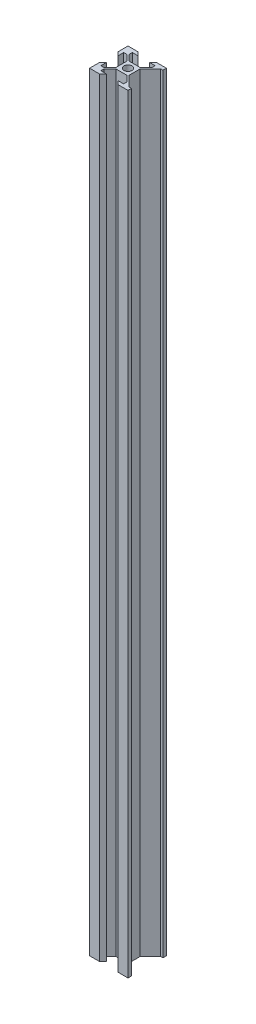
from build123d import *

# Parameters (mm, degrees)
EXTRUDE_1_DEPTH          = 400
CUT_EXTRUDE_1_DEPTH      = 404.236903073
CUT_EXTRUDE_1_DEPTH_BACK = 404.236903073
SKETCH_2_W               = 44.352947912
SKETCH_2_H               = 26.447385174


with BuildPart() as part:
    # 草图1 → 凸台-拉伸1 (new body)
    with BuildSketch(Plane(origin=(0, 0, 0), x_dir=(1, 0, 0), z_dir=(0, 1, 0))):
        with BuildLine():
            Line((-3.476396103, 2.84), (-3.476396103, 0))
            Line((-3.476396103, 0), (-2.1, 0))
            ThreePointArc((-2.1, 0), (-1.48492424, 1.48492424), (0, 2.1))
            Line((0, 2.1), (0, 3.476396103))
            Line((0, 3.476396103), (-2.84, 3.476396103))
            Line((-2.84, 3.476396103), (-5.923603897, 6.56))
            Line((-5.923603897, 6.56), (-5.923603897, 8.2))
            Line((-5.923603897, 8.2), (-3.1, 8.2))
            Line((-3.1, 8.2), (-4.9, 10))
            Line((-4.9, 10), (-10, 10))
            Line((-10, 10), (-10, 4.9))
            Line((-10, 4.9), (-8.2, 3.1))
            Line((-8.2, 3.1), (-8.2, 5.923603897))
            Line((-8.2, 5.923603897), (-6.56, 5.923603897))
            Line((-6.56, 5.923603897), (-3.476396103, 2.84))
        make_face()
        with BuildLine():
            Line((-2.1, 0), (-3.476396103, 0))
            Line((-3.476396103, 0), (-3.476396103, -2.84))
            Line((-3.476396103, -2.84), (-6.56, -5.923603897))
            Line((-6.56, -5.923603897), (-8.2, -5.923603897))
            Line((-8.2, -5.923603897), (-8.2, -3.1))
            Line((-8.2, -3.1), (-10, -4.9))
            Line((-10, -4.9), (-10, -10))
            Line((-10, -10), (-4.9, -10))
            Line((-4.9, -10), (-3.1, -8.2))
            Line((-3.1, -8.2), (-5.923603897, -8.2))
            Line((-5.923603897, -8.2), (-5.923603897, -6.56))
            Line((-5.923603897, -6.56), (-2.84, -3.476396103))
            Line((-2.84, -3.476396103), (0, -3.476396103))
            Line((0, -3.476396103), (0, -2.1))
            ThreePointArc((0, -2.1), (-1.48492424, -1.48492424), (-2.1, 0))
        make_face()
        with BuildLine():
            ThreePointArc((2.1, 0), (1.48492424, -1.48492424), (0, -2.1))
            Line((0, -2.1), (0, -3.476396103))
            Line((0, -3.476396103), (2.84, -3.476396103))
            Line((2.84, -3.476396103), (5.923603897, -6.56))
            Line((5.923603897, -6.56), (5.923603897, -8.2))
            Line((5.923603897, -8.2), (3.1, -8.2))
            Line((3.1, -8.2), (4.9, -10))
            Line((4.9, -10), (15.1, -10))
            Line((15.1, -10), (16.9, -8.2))
            Line((16.9, -8.2), (14.076396103, -8.2))
            Line((14.076396103, -8.2), (14.076396103, -6.56))
            Line((14.076396103, -6.56), (17.16, -3.476396103))
            Line((17.16, -3.476396103), (20, -3.476396103))
            Line((20, -3.476396103), (20, -2.1))
            ThreePointArc((20, -2.1), (18.51507576, -1.48492424), (17.9, 0))
            Line((17.9, 0), (16.523603897, 0))
            Line((16.523603897, 0), (16.523603897, -2.84))
            Line((16.523603897, -2.84), (13.44, -5.923603897))
            Line((13.44, -5.923603897), (11.163603897, -8.2))
            Line((11.163603897, -8.2), (8.836396103, -8.2))
            Line((8.836396103, -8.2), (6.56, -5.923603897))
            Line((6.56, -5.923603897), (3.476396103, -2.84))
            Line((3.476396103, -2.84), (3.476396103, 0))
            Line((3.476396103, 0), (2.1, 0))
        make_face()
        with BuildLine():
            Line((0, 3.476396103), (0, 2.1))
            ThreePointArc((0, 2.1), (1.48492424, 1.48492424), (2.1, 0))
            Line((2.1, 0), (3.476396103, 0))
            Line((3.476396103, 0), (3.476396103, 2.84))
            Line((3.476396103, 2.84), (6.56, 5.923603897))
            Line((6.56, 5.923603897), (8.836396103, 8.2))
            Line((8.836396103, 8.2), (11.163603897, 8.2))
            Line((11.163603897, 8.2), (13.44, 5.923603897))
            Line((13.44, 5.923603897), (16.523603897, 2.84))
            Line((16.523603897, 2.84), (16.523603897, 0))
            Line((16.523603897, 0), (17.9, 0))
            ThreePointArc((17.9, 0), (18.51507576, 1.48492424), (20, 2.1))
            Line((20, 2.1), (20, 3.476396103))
            Line((20, 3.476396103), (17.16, 3.476396103))
            Line((17.16, 3.476396103), (14.076396103, 6.56))
            Line((14.076396103, 6.56), (14.076396103, 8.2))
            Line((14.076396103, 8.2), (16.9, 8.2))
            Line((16.9, 8.2), (15.1, 10))
            Line((15.1, 10), (4.9, 10))
            Line((4.9, 10), (3.1, 8.2))
            Line((3.1, 8.2), (5.923603897, 8.2))
            Line((5.923603897, 8.2), (5.923603897, 6.56))
            Line((5.923603897, 6.56), (2.84, 3.476396103))
            Line((2.84, 3.476396103), (0, 3.476396103))
        make_face()
        with BuildLine():
            Line((20, 3.476396103), (20, 2.1))
            ThreePointArc((20, 2.1), (21.48492424, 1.48492424), (22.1, 0))
            Line((22.1, 0), (23.476396103, 0))
            Line((23.476396103, 0), (23.476396103, 2.84))
            Line((23.476396103, 2.84), (26.56, 5.923603897))
            Line((26.56, 5.923603897), (28.836396103, 8.2))
            Line((28.836396103, 8.2), (31.163603897, 8.2))
            Line((31.163603897, 8.2), (33.44, 5.923603897))
            Line((33.44, 5.923603897), (36.523603897, 2.84))
            Line((36.523603897, 2.84), (36.523603897, 0))
            Line((36.523603897, 0), (37.9, 0))
            ThreePointArc((37.9, 0), (40, 2.1), (42.1, 0))
            Line((42.1, 0), (43.476396103, 0))
            Line((43.476396103, 0), (43.476396103, 2.84))
            Line((43.476396103, 2.84), (46.56, 5.923603897))
            Line((46.56, 5.923603897), (48.2, 5.923603897))
            Line((48.2, 5.923603897), (48.2, 3.1))
            Line((48.2, 3.1), (50, 4.9))
            Line((50, 4.9), (50, 10))
            Line((50, 10), (44.9, 10))
            Line((44.9, 10), (43.1, 8.2))
            Line((43.1, 8.2), (45.923603897, 8.2))
            Line((45.923603897, 8.2), (45.923603897, 6.56))
            Line((45.923603897, 6.56), (42.84, 3.476396103))
            Line((42.84, 3.476396103), (37.16, 3.476396103))
            Line((37.16, 3.476396103), (34.076396103, 6.56))
            Line((34.076396103, 6.56), (34.076396103, 8.2))
            Line((34.076396103, 8.2), (36.9, 8.2))
            Line((36.9, 8.2), (35.1, 10))
            Line((35.1, 10), (24.9, 10))
            Line((24.9, 10), (23.1, 8.2))
            Line((23.1, 8.2), (25.923603897, 8.2))
            Line((25.923603897, 8.2), (25.923603897, 6.56))
            Line((25.923603897, 6.56), (22.84, 3.476396103))
            Line((22.84, 3.476396103), (20, 3.476396103))
        make_face()
        with BuildLine():
            ThreePointArc((22.1, 0), (21.48492424, -1.48492424), (20, -2.1))
            Line((20, -2.1), (20, -3.476396103))
            Line((20, -3.476396103), (22.84, -3.476396103))
            Line((22.84, -3.476396103), (25.923603897, -6.56))
            Line((25.923603897, -6.56), (25.923603897, -8.2))
            Line((25.923603897, -8.2), (23.1, -8.2))
            Line((23.1, -8.2), (24.9, -10))
            Line((24.9, -10), (35.1, -10))
            Line((35.1, -10), (36.9, -8.2))
            Line((36.9, -8.2), (34.076396103, -8.2))
            Line((34.076396103, -8.2), (34.076396103, -6.56))
            Line((34.076396103, -6.56), (37.16, -3.476396103))
            Line((37.16, -3.476396103), (42.84, -3.476396103))
            Line((42.84, -3.476396103), (45.923603897, -6.56))
            Line((45.923603897, -6.56), (45.923603897, -8.2))
            Line((45.923603897, -8.2), (43.1, -8.2))
            Line((43.1, -8.2), (44.9, -10))
            Line((44.9, -10), (50, -10))
            Line((50, -10), (50, -4.9))
            Line((50, -4.9), (48.2, -3.1))
            Line((48.2, -3.1), (48.2, -5.923603897))
            Line((48.2, -5.923603897), (46.56, -5.923603897))
            Line((46.56, -5.923603897), (43.476396103, -2.84))
            Line((43.476396103, -2.84), (43.476396103, 0))
            Line((43.476396103, 0), (42.1, 0))
            ThreePointArc((42.1, 0), (40, -2.1), (37.9, 0))
            Line((37.9, 0), (36.523603897, 0))
            Line((36.523603897, 0), (36.523603897, -2.84))
            Line((36.523603897, -2.84), (33.44, -5.923603897))
            Line((33.44, -5.923603897), (31.163603897, -8.2))
            Line((31.163603897, -8.2), (28.836396103, -8.2))
            Line((28.836396103, -8.2), (26.56, -5.923603897))
            Line((26.56, -5.923603897), (23.476396103, -2.84))
            Line((23.476396103, -2.84), (23.476396103, 0))
            Line((23.476396103, 0), (22.1, 0))
        make_face()
    extrude(amount=EXTRUDE_1_DEPTH)

    # 草图2 → 切除-拉伸1 (cut, two sides: drawn at the far end of the back side and taken through both)
    with BuildSketch(Plane(origin=(0, 400, 0), x_dir=(1, 0, 0), z_dir=(0, 1, 0)).offset(-CUT_EXTRUDE_1_DEPTH_BACK)):
        with Locations((32.176473956, -3.223692587)):
            Rectangle(SKETCH_2_W, SKETCH_2_H)
    extrude(amount=CUT_EXTRUDE_1_DEPTH + CUT_EXTRUDE_1_DEPTH_BACK, mode=Mode.SUBTRACT)


solid = part.part
